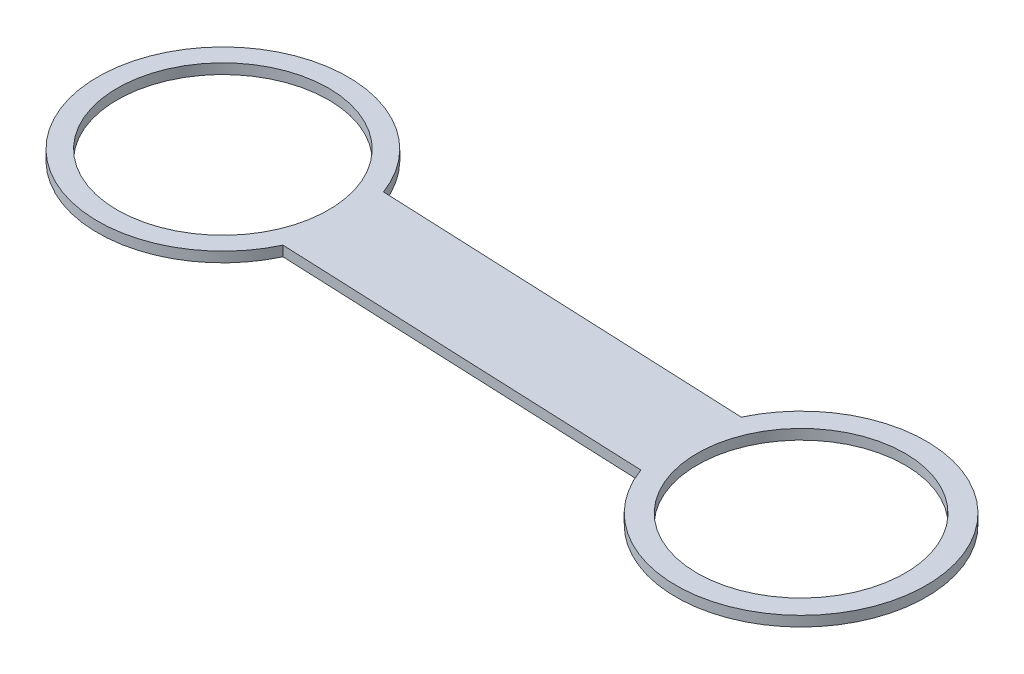
from build123d import *

# Parameters (mm, degrees)
SKETCH1_R           = 31.242
SKETCH1_R_2         = 30.734
BOSS_EXTRUDE1_DEPTH = 3


with BuildPart() as part:
    # Sketch1 → Boss-Extrude1 (new body)
    with BuildSketch(Plane(origin=(0, 0, 0), x_dir=(1, 0, 0), z_dir=(0, 1, 0))):
        with BuildLine():
            Line((34.724455341, 12.775453074), (145.341023247, 8.00004525))
            ThreePointArc((145.341023247, 8.00004525), (215.771836356, -9.474231493), (144.033066178, -20.401199793))
            Line((144.033066178, -20.401199793), (33.495414057, -15.718054496))
            ThreePointArc((33.495414057, -15.718054496), (-36.965627799, 1.594478411), (34.724455341, 12.775453074))
        make_face()
        with Locations(Location((0, 0, 0), (0, 0, 270))):
            Circle(SKETCH1_R, mode=Mode.SUBTRACT)
        with Locations(Location((178.811009986, -7.772081673, 0), (0, 0, 270))):
            Circle(SKETCH1_R_2, mode=Mode.SUBTRACT)
    extrude(amount=BOSS_EXTRUDE1_DEPTH)


solid = part.part
